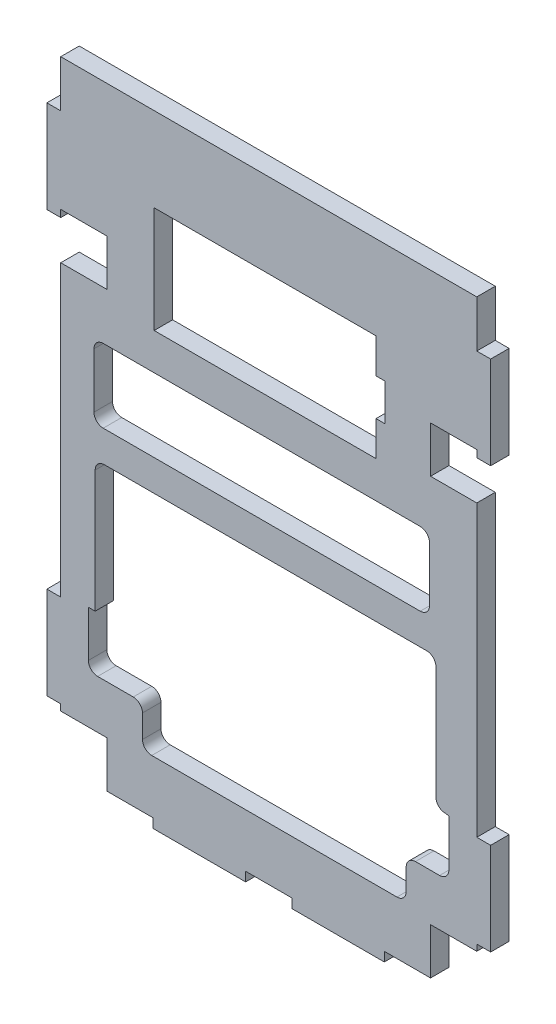
from build123d import *

# Parameters (mm, degrees)
EXTRUDE_1_DEPTH = 2


with BuildPart() as part:
    # Model → 凸台-拉伸1 (new body)
    with BuildSketch(Plane.XY):
        Polygon((1417.579456282, 528.777626172), (1417.579456282, 523.704047707), (1419.079456282, 523.704047707), (1419.079456282, 513.704047707), (1417.579456282, 513.704047707), (1417.579456282, 514.474245762), (1412.579456282, 514.474245762), (1412.579456282, 509.474245762), (1417.579456282, 509.474245762), (1417.579456282, 478.155095762), (1419.079456282, 478.155095762), (1419.079456282, 468.155095762), (1417.579456282, 468.155095762), (1417.579456282, 467.474245762), (1412.579456282, 467.474245762), (1412.579456282, 462.474245762), (1407.579456282, 462.474245762), (1407.579456282, 461.474245762), (1397.579456282, 461.474245762), (1397.579456282, 462.474245762), (1392.579456282, 462.474245762), (1392.579456282, 461.474245762), (1382.579456282, 461.474245762), (1382.579456282, 462.474245762), (1377.579456282, 462.474245762), (1377.579456282, 467.474245762), (1372.579456282, 467.474245762), (1372.579456282, 468.155095762), (1371.079456282, 468.155095762), (1371.079456282, 478.155095762), (1372.579456282, 478.155095762), (1372.579456282, 509.474245762), (1377.579456282, 509.474245762), (1377.579456282, 514.474245762), (1372.579456282, 514.474245762), (1372.579456282, 513.704047707), (1371.079456282, 513.704047707), (1371.079456282, 523.704047707), (1372.579456282, 523.704047707), (1372.579456282, 528.777626172), align=None)
        with BuildLine():
            Line((1413.164476571, 491.917810861), (1413.164476571, 479.70647297))
            ThreePointArc((1413.164476571, 479.70647297), (1413.457369789, 478.999366189), (1414.164476571, 478.70647297))
            Line((1414.164476571, 478.70647297), (1414.555223152, 478.654447188))
            Line((1414.555223152, 478.654447188), (1414.555223152, 473.567457634))
            ThreePointArc((1414.555223152, 473.567457634), (1414.262329933, 472.860350852), (1413.555223152, 472.567457634))
            Line((1413.555223152, 472.567457634), (1410.947178647, 472.567457634))
            ThreePointArc((1410.947178647, 472.567457634), (1410.240071866, 472.274564415), (1409.947178647, 471.567457634))
            Line((1409.947178647, 471.567457634), (1409.947178647, 469.239749487))
            ThreePointArc((1409.947178647, 469.239749487), (1409.654285428, 468.532642706), (1408.947178647, 468.239749487))
            Line((1408.947178647, 468.239749487), (1382.420404996, 468.239749487))
            ThreePointArc((1382.420404996, 468.239749487), (1381.713298215, 468.532642706), (1381.420404996, 469.239749487))
            Line((1381.420404996, 469.239749487), (1381.420404996, 471.721090549))
            ThreePointArc((1381.420404996, 471.721090549), (1381.127511777, 472.428197331), (1380.420404996, 472.721090549))
            Line((1380.420404996, 472.721090549), (1376.569778947, 472.721090549))
            ThreePointArc((1376.569778947, 472.721090549), (1375.862672166, 473.013983768), (1375.569778947, 473.721090549))
            Line((1375.569778947, 473.721090549), (1375.569778947, 478.699498863))
            Line((1375.569778947, 478.699498863), (1376.305086446, 478.699498863))
            Line((1376.305086446, 478.699498863), (1376.305086446, 491.917810861))
            ThreePointArc((1376.305086446, 491.917810861), (1376.597979665, 492.624917642), (1377.305086446, 492.917810861))
            Line((1377.305086446, 492.917810861), (1412.164476571, 492.917810861))
            ThreePointArc((1412.164476571, 492.917810861), (1412.871583352, 492.624917642), (1413.164476571, 491.917810861))
        make_face(mode=Mode.SUBTRACT)
        Polygon((1382.679456282, 519.677225349), (1406.679456282, 519.677225349), (1406.679456282, 515.927225349), (1407.679456282, 515.927225349), (1407.679456282, 511.927225349), (1406.679456282, 511.927225349), (1406.679456282, 508.177225349), (1382.679456282, 508.177225349), align=None, mode=Mode.SUBTRACT)
        with BuildLine():
            Line((1411.462010719, 504.216917745), (1377.175235328, 504.216917745))
            ThreePointArc((1377.175235328, 504.216917745), (1376.468128547, 503.924024527), (1376.175235328, 503.216917745))
            Line((1376.175235328, 503.216917745), (1376.175235328, 497.276748548))
            ThreePointArc((1376.175235328, 497.276748548), (1376.468128547, 496.569641766), (1377.175235328, 496.276748548))
            Line((1377.175235328, 496.276748548), (1411.462010719, 496.276748548))
            ThreePointArc((1411.462010719, 496.276748548), (1412.1691175, 496.569641766), (1412.462010719, 497.276748548))
            Line((1412.462010719, 497.276748548), (1412.462010719, 503.216917745))
            ThreePointArc((1412.462010719, 503.216917745), (1412.1691175, 503.924024527), (1411.462010719, 504.216917745))
        make_face(mode=Mode.SUBTRACT)
    extrude(amount=EXTRUDE_1_DEPTH)


solid = part.part
